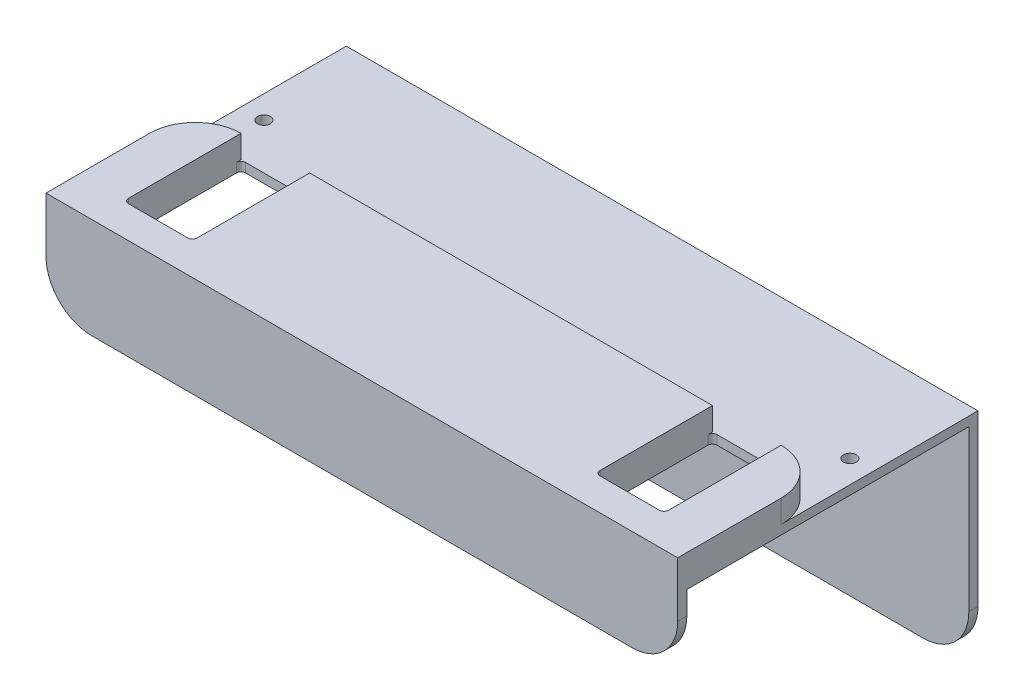
from build123d import *

# Parameters (mm, degrees)
SKETCH_1_W          = 138
SKETCH_1_H          = 65.6
SKETCH_1_R          = 1.4
EXTRUDE_1_DEPTH     = 2
SKETCH_2_W          = 138
SKETCH_2_H          = 32.6
EXTRUDE_2_DEPTH     = 5
SKETCH_3_W          = 138
SKETCH_3_H          = 2
EXTRUDE_3_DEPTH     = 45
FILLET_1_R          = 10
SKETCH_5_W          = 138
SKETCH_5_H          = 2
EXTRUDE_4_DEPTH     = 15
FILLET_2_R          = 10
CUT_EXTRUDE_1_REACH = 90.667
SKETCH_6_W          = 15
SKETCH_6_H          = 25.6
FILLET_3_R          = 1
FILLET_4_R          = 1


with BuildPart() as part:
    # 草图1 → 凸台-拉伸1 (new body)
    with BuildSketch(Plane(origin=(0, 0, 0), x_dir=(1, 0, 0), z_dir=(0, 1, 0))):
        Rectangle(SKETCH_1_W, SKETCH_1_H)
        with Locations(Location((-64, 9.8, 0), (0, 0, 270))):
            Circle(SKETCH_1_R, mode=Mode.SUBTRACT)
        with Locations(Location((64, 9.8, 0), (0, 0, 270))):
            Circle(SKETCH_1_R, mode=Mode.SUBTRACT)
    extrude(amount=EXTRUDE_1_DEPTH)

    # 草图2 → 凸台-拉伸2 (add)
    with BuildSketch(Plane(origin=(0, 2, 0), x_dir=(1, 0, 0), z_dir=(0, 1, 0))):
        with Locations((0, -16.5)):
            Rectangle(SKETCH_2_W, SKETCH_2_H)
    extrude(amount=EXTRUDE_2_DEPTH)

    # 草图3 → 凸台-拉伸3 (add)
    with BuildSketch(Plane.XZ):
        with Locations((0, -31.8)):
            Rectangle(SKETCH_3_W, SKETCH_3_H)
    extrude(amount=EXTRUDE_3_DEPTH)

    # 圆角1
    fillet_1_edges = [part.edges().sort_by_distance(p)[0] for p in [
        (-69, 4.5, 0.2),
        (69, 4.5, 0.2),
    ]]
    fillet(fillet_1_edges, radius=FILLET_1_R)

    # 草图5 → 凸台-拉伸4 (add)
    with BuildSketch(Plane.XZ):
        with Locations((0, 31.8)):
            Rectangle(SKETCH_5_W, SKETCH_5_H)
    extrude(amount=EXTRUDE_4_DEPTH)

    # 圆角2
    fillet_2_edges = [part.edges().sort_by_distance(p)[0] for p in [
        (-69, -45, -31.8),
        (69, -45, -31.8),
        (-69, -15, 31.8),
        (69, -15, 31.8),
    ]]
    fillet(fillet_2_edges, radius=FILLET_2_R)

    # 切除-拉伸1: up to this face of the body (flat: up to its plane)
    cut_extrude_1_end = Plane(part.part.faces().sort_by_distance((0, 7, 16.635491013))[0])
    # 草图6 → 切除-拉伸1 (cut, up to the picked face)
    with BuildSketch(Plane.XZ, mode=Mode.PRIVATE) as cut_extrude_1_sk1:
        with Locations((-51.5, 13)):
            Rectangle(SKETCH_6_W, SKETCH_6_H)
    cut_extrude_1_tool1 = split(extrude(cut_extrude_1_sk1.sketch, amount=-CUT_EXTRUDE_1_REACH, mode=Mode.PRIVATE), bisect_by=cut_extrude_1_end, keep=Keep.BOTH, mode=Mode.PRIVATE)
    # 草图6 → 切除-拉伸1 (cut, up to the picked face)
    with BuildSketch(Plane.XZ, mode=Mode.PRIVATE) as cut_extrude_1_sk2:
        with Locations((51.5, 13)):
            Rectangle(SKETCH_6_W, SKETCH_6_H)
    cut_extrude_1_tool2 = split(extrude(cut_extrude_1_sk2.sketch, amount=-CUT_EXTRUDE_1_REACH, mode=Mode.PRIVATE), bisect_by=cut_extrude_1_end, keep=Keep.BOTH, mode=Mode.PRIVATE)
    add(cut_extrude_1_tool1.solids().sort_by(Axis((-51.5, 0, 13), (0, 1, 0)))[0], mode=Mode.SUBTRACT)
    add(cut_extrude_1_tool2.solids().sort_by(Axis((51.5, 0, 13), (0, 1, 0)))[0], mode=Mode.SUBTRACT)

    # 圆角3
    fillet_3_edges = [part.edges().sort_by_distance(p)[0] for p in [
        (-59, 3.5, 25.8),
        (-44, 3.5, 25.8),
        (59, 3.5, 25.8),
        (44, 3.5, 25.8),
    ]]
    fillet(fillet_3_edges, radius=FILLET_3_R)

    # 圆角4
    fillet_4_edges = [part.edges().sort_by_distance(p)[0] for p in [
        (-44, 1, 0.2),
        (-59, 1, 0.2),
        (59, 1, 0.2),
        (44, 1, 0.2),
    ]]
    fillet(fillet_4_edges, radius=FILLET_4_R)


solid = part.part
